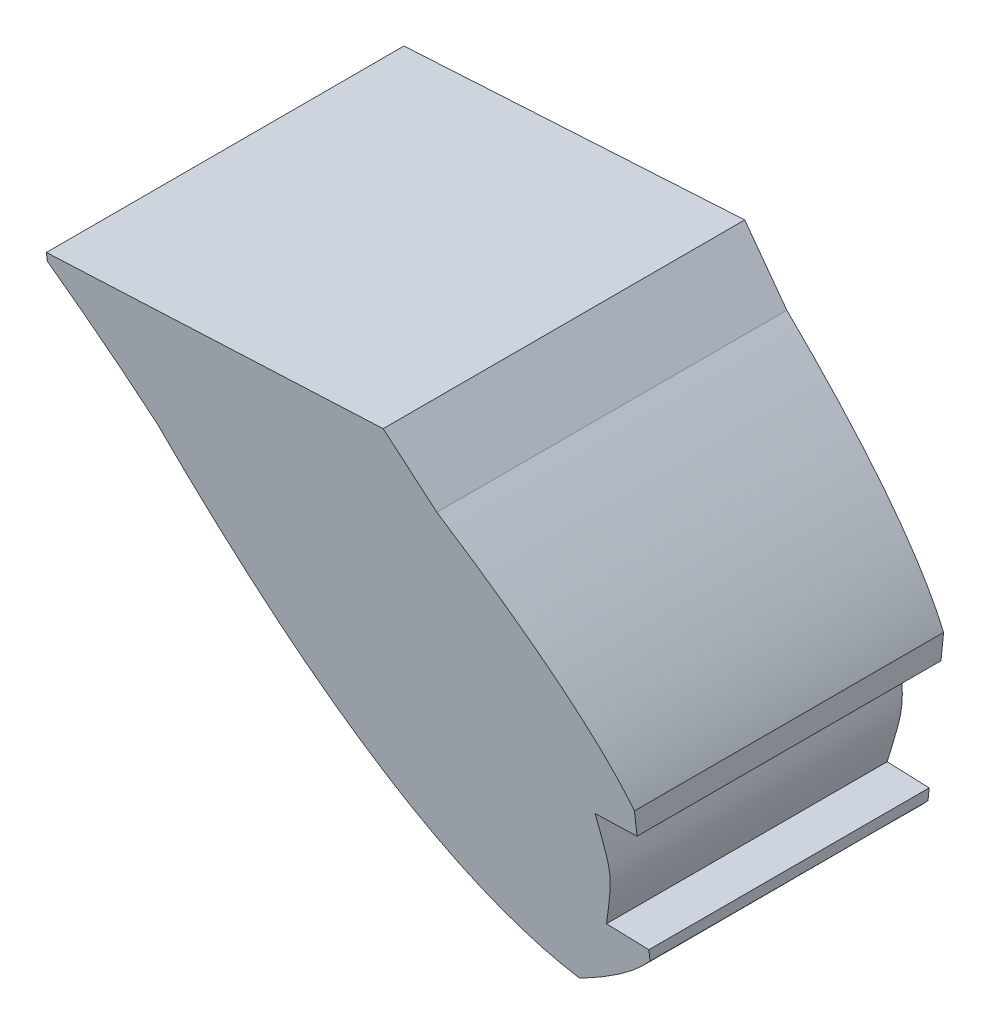
from build123d import *

# Parameters (mm, degrees)
SALIENTE_EXTRUIR1_DEPTH      = 7.5
SALIENTE_EXTRUIR2_DEPTH      = 7.5
SALIENTE_EXTRUIR2_DEPTH_BACK = 7.5
CORTAR_EXTRUIR2_DEPTH        = 28.310606886
CORTAR_EXTRUIR2_DEPTH_BACK   = 28.310606886


with BuildPart() as part:
    # Croquis1 → Saliente-Extruir1 (new, symmetric)
    with BuildSketch(Plane.XY):
        with BuildLine():
            add(Edge.make_bspline(
                [(-18.945192114, 7.540918896), (-10.215008384, -3.697644103), (-2.846604825, -5.059081104)],
                knots=[0.497667241, 0.497667241, 0.497667241, 0.49955428, 0.49955428, 0.49955428], degree=2, weights=[1, 1, 1]))
            add(Edge.make_bspline(
                [(-2.846604825, -5.059081104), (-0.742366882, -3.9352066), (0.355125, -2.723253227)],
                knots=[0.498812075, 0.498812075, 0.498812075, 0.499412845, 0.499412845, 0.499412845], degree=2, weights=[1, 1, 1]))
            Line((0.355125, -2.723253227), (0.355125, -2.284841781))
            Line((0.355125, -2.284841781), (-1.394875, -2.223730435))
            add(Edge.make_bspline(
                [(-1.394875, -2.223730435), (-0.90753067, -0.123730435), (-1.394875, 1.976269565)],
                knots=[0, 0, 0, 1, 1, 1], degree=2, weights=[1, 3.231801219, 1]))
            Line((-1.394875, 1.976269565), (0.355125, 2.284841781))
            Line((0.355125, 2.284841781), (0.355125, 3.001549529))
            add(Edge.make_bspline(
                [(0.355125, 3.001549529), (-1.44872627, 6.058427314), (-6.994875026, 10.477389992)],
                knots=[0.500820705, 0.500820705, 0.500820705, 0.502013312, 0.502013312, 0.502013312], degree=2, weights=[1, 1, 1]))
            Line((-6.994875026, 10.477389992), (-8.981845695, 12.608155172))
            Line((-8.981845695, 12.608155172), (-23.035921146, 11.871612288))
            Line((-23.035921146, 11.871612288), (-23.035921146, 11.54013782))
            ThreePointArc((-23.035921146, 11.54013782), (-20.949684518, 9.582335705), (-18.945192114, 7.540918896))
        make_face()
    extrude(amount=SALIENTE_EXTRUIR1_DEPTH, both=True)

    # Croquis4 → Saliente-Extruir2 (add, two sides: drawn at the far end of the back side and taken through both)
    with BuildSketch(Plane.XY.offset(-SALIENTE_EXTRUIR2_DEPTH_BACK)):
        Polygon((-1.394875, 1.976269565), (0.355125, 2.284841781), (0.355125, 2.037380912), align=None)
    extrude(amount=SALIENTE_EXTRUIR2_DEPTH + SALIENTE_EXTRUIR2_DEPTH_BACK)

    # Croquis6 → Cortar-Extruir2 (cut, two sides: drawn at the far end of the back side and taken through both)
    with BuildSketch(Plane(origin=(0, 0, 0), x_dir=(0, 0, -1), z_dir=(1, 0, 0)).offset(-CORTAR_EXTRUIR2_DEPTH_BACK)):
        Polygon((7.5, 12.608155172), (7.5, -5.059081104), (5.5, -5.059081104), align=None)
        Polygon((-7.5, 12.608155172), (-7.5, -5.059081104), (-5.5, -5.059081104), align=None)
    extrude(amount=CORTAR_EXTRUIR2_DEPTH + CORTAR_EXTRUIR2_DEPTH_BACK, mode=Mode.SUBTRACT)


solid = part.part
